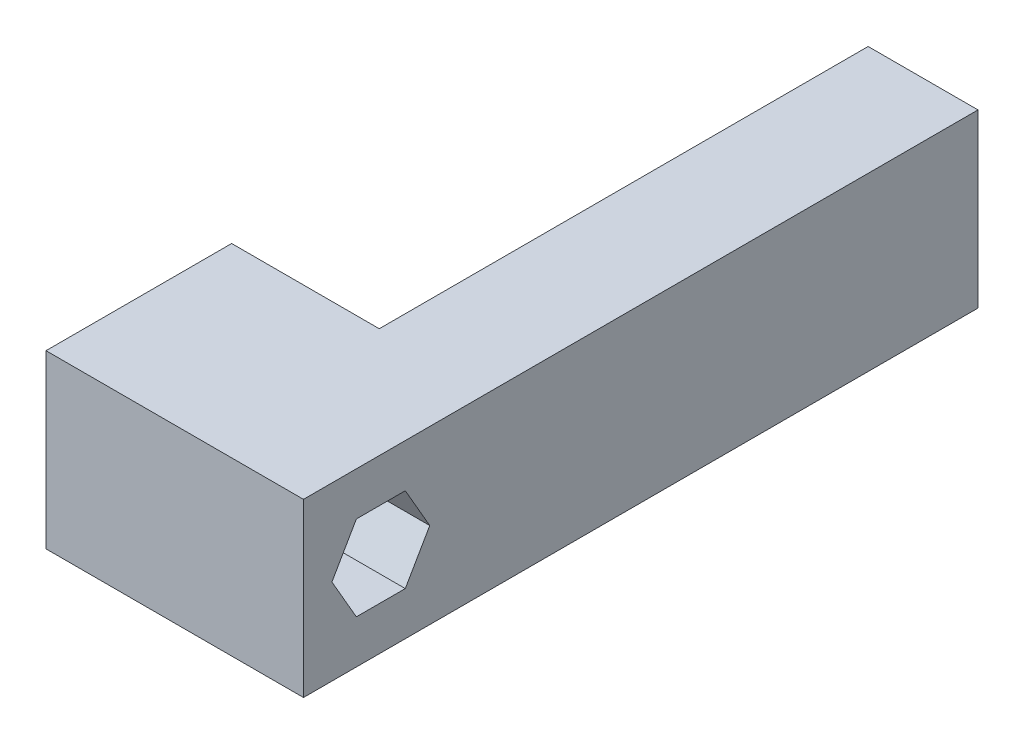
from build123d import *

# Parameters (mm, degrees)
SKETCH1_W           = 75.411469328
SKETCH1_H           = 25.4
BOSS_EXTRUDE1_DEPTH = 12.7
SKETCH3_W           = 12.7
SKETCH3_H           = 25.4
BOSS_EXTRUDE2_DEPTH = 25.4
SKETCH4_W           = 7.642985312
SKETCH4_H           = 25.4
BOSS_EXTRUDE4_DEPTH = 25.4
SKETCH5_W           = 72.340144766
SKETCH5_H           = 25.4
CUT_EXTRUDE1_DEPTH  = 6.604
SKETCH6_W           = 20.82833925
SKETCH6_H           = 25.4
BOSS_EXTRUDE5_DEPTH = 25.4
SKETCH7_W           = 72.340144766
SKETCH7_H           = 25.4
BOSS_EXTRUDE6_DEPTH = 10.16
SKETCH8_W           = 38.1
SKETCH8_H           = 25.4
CUT_EXTRUDE2_DEPTH  = 1


with BuildPart() as part:
    # Sketch1 → Boss-Extrude1 (new body)
    with BuildSketch(Plane(origin=(0, 0, 0), x_dir=(0, 0, -1), z_dir=(1, 0, 0))):
        with Locations((37.705734664, -12.7)):
            Rectangle(SKETCH1_W, SKETCH1_H)
        Polygon((19.685, -12.7), (16.0655, -6.430842102), (8.8265, -6.430842102), (5.207, -12.7), (8.8265, -18.969157898), (16.0655, -18.969157898), align=None, mode=Mode.SUBTRACT)
    extrude(amount=BOSS_EXTRUDE1_DEPTH)

    # Sketch3 → Boss-Extrude2 (add)
    with BuildSketch(Plane(origin=(0, 0, -75.411469328), x_dir=(-1, 0, 0), z_dir=(0, 0, -1))):
        with Locations((-6.35, -12.7)):
            Rectangle(SKETCH3_W, SKETCH3_H)
    extrude(amount=BOSS_EXTRUDE2_DEPTH)

    # Sketch4 → Boss-Extrude4 (add)
    with BuildSketch(Plane.ZY):
        with Locations((-24.649831906, -12.7)):
            Rectangle(SKETCH4_W, SKETCH4_H)
    extrude(amount=BOSS_EXTRUDE4_DEPTH)

    # Sketch5 → Cut-Extrude1 (cut)
    with BuildSketch(Plane.ZY):
        with Locations((-64.641396945, -12.7)):
            Rectangle(SKETCH5_W, SKETCH5_H)
    extrude(amount=-CUT_EXTRUDE1_DEPTH, mode=Mode.SUBTRACT)

    # Sketch6 → Boss-Extrude5 (add)
    with BuildSketch(Plane.ZY):
        with Locations((-10.414169625, -12.7)):
            Rectangle(SKETCH6_W, SKETCH6_H)
        Polygon((-8.8265, -6.430842102), (-16.0655, -6.430842102), (-19.685, -12.7), (-16.0655, -18.969157898), (-8.8265, -18.969157898), (-5.207, -12.7), align=None, mode=Mode.SUBTRACT)
    extrude(amount=BOSS_EXTRUDE5_DEPTH)

    # Sketch7 → Boss-Extrude6 (add)
    with BuildSketch(Plane.ZY.offset(-6.604)):
        with Locations((-64.641396945, -12.7)):
            Rectangle(SKETCH7_W, SKETCH7_H)
    extrude(amount=BOSS_EXTRUDE6_DEPTH)

    # Sketch8 → Cut-Extrude2 (cut)
    with BuildSketch(Plane.XY):
        with Locations((-6.35, -12.7)):
            Rectangle(SKETCH8_W, SKETCH8_H)
    extrude(amount=-CUT_EXTRUDE2_DEPTH, mode=Mode.SUBTRACT)


solid = part.part
